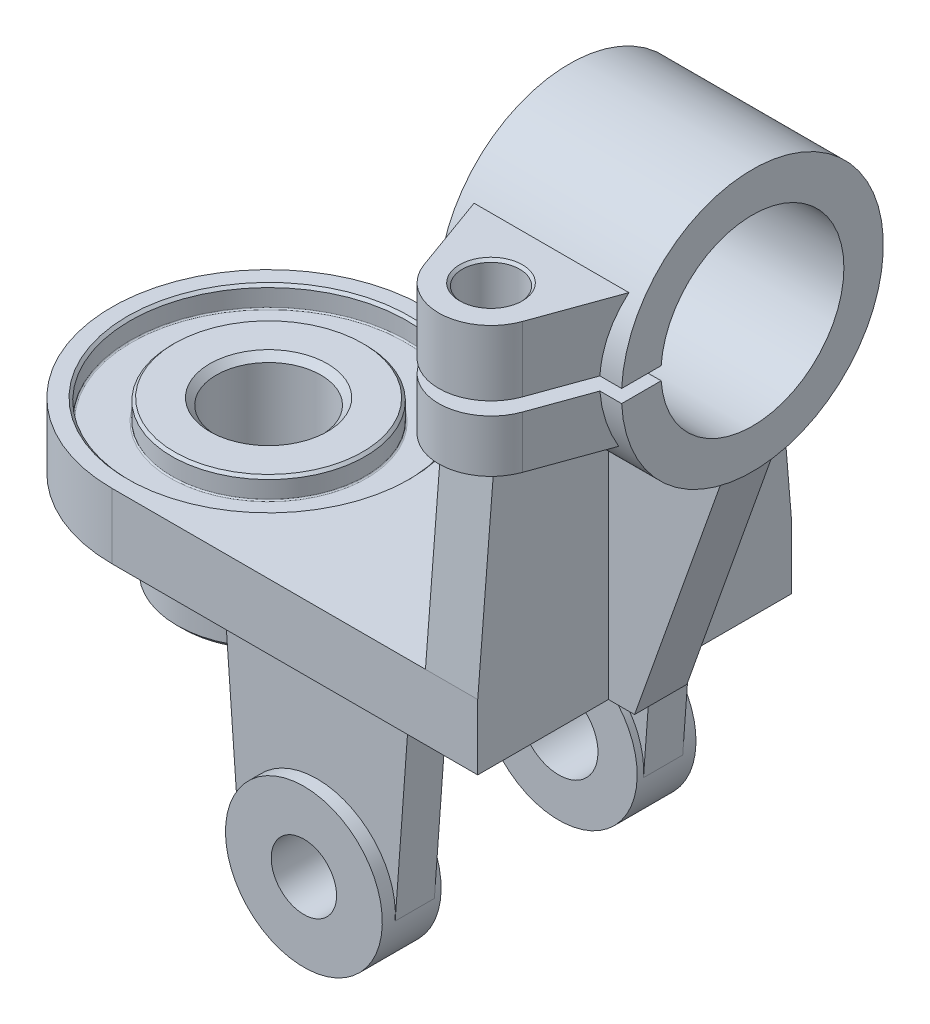
from build123d import *
from build123d.topology import SkipClean

# Parameters (mm, degrees)
CHAMFER_1_SIZE        = 2
CHAMFER_2_SIZE        = 2.5
CHAMFER_3_SIZE        = 1
FILLET_1_R            = 0.5
EXTRUDE_START         = -25
EXTRUDE_2_DEPTH       = 25
SKETCH_6_W            = 20
SKETCH_6_H            = 120
EXTRUDE_3_DEPTH       = 118
CUT_EXTRUDE_1_DEPTH   = 118
EXTRUDE_5_DEPTH       = 5
EXTRUDE_5_DEPTH_BACK  = 65
SKETCH_9_R            = 50.086542483
CUT_EXTRUDE_4_DEPTH   = 94
EXTRUDE_6_DEPTH       = 70
EXTRUDE_6_2_DEPTH     = 70
SKETCH_12_OUTSIDE_W   = 319.952
SKETCH_12_OUTSIDE_H   = 219.865
CUT_EXTRUDE_5_DEPTH   = 70
SKETCH_13_R           = 11
CUT_EXTRUDE_6_DEPTH   = 25
SKETCH_14_R           = 10
CUT_EXTRUDE_7_DEPTH   = 20
CHAMFER_4_SIZE        = 1
SKETCH_15_W           = 22.5
SKETCH_15_H           = 30
SKETCH_16_W           = 101.527747387
SKETCH_16_H           = 88.176453892
EXTRUDE_7_DEPTH       = 20
SKETCH_16_3_W         = 101.527747387
SKETCH_16_3_H         = 88.176453892
CUT_EXTRUDE_8_DEPTH   = 5
SKETCH_17_OUTSIDE_W   = 328.284
SKETCH_17_OUTSIDE_H   = 373.371
CUT_EXTRUDE_9_DEPTH   = 31
SKETCH_18_R           = 12.5
CUT_EXTRUDE_10_DEPTH  = 31
SKETCH_19_R           = 15
CUT_EXTRUDE_11_DEPTH  = 31
EXTRUDE_10_DEPTH      = 10
EXTRUDE_10_DEPTH_BACK = 10


with BuildPart() as part:
    # Эскиз1 → Повернуть1 (revolve)
    with BuildSketch(Plane.XY):
        Polygon((-20, 0), (-37, 0), (-37, -8), (-53, -8), (-53, 0), (-60, 0), (-60, -25), (-35, -25), (-35, -60), (-20, -60), align=None)
    revolve(axis=Axis((0, 0, 0), (0, -1, 0)))

    # Фаска1
    chamfer_1_edges = [part.edges().sort_by_distance(p)[0] for p in [
        (35, -60, 0),
    ]]
    chamfer(chamfer_1_edges, length=CHAMFER_1_SIZE)

    # Фаска2
    chamfer_2_edges = [part.edges().sort_by_distance(p)[0] for p in [
        (20, 0, 0),
    ]]
    chamfer(chamfer_2_edges, length=CHAMFER_2_SIZE)

    # Фаска3
    chamfer_3_edges = [part.edges().sort_by_distance(p)[0] for p in [
        (37, 0, 0),
        (53, 0, 0),
    ]]
    chamfer(chamfer_3_edges, length=CHAMFER_3_SIZE)

    # Скругление1
    fillet_1_edges = [part.edges().sort_by_distance(p)[0] for p in [
        (37, -8, 0),
        (53, -8, 0),
    ]]
    fillet(fillet_1_edges, radius=FILLET_1_R)

    # Эскиз5 → Бобышка-Вытянуть2 (add)
    with BuildSketch(Plane(origin=(0, 0, 0), x_dir=(1, 0, 0), z_dir=(0, 1, 0)).offset(EXTRUDE_START)):
        with BuildLine():
            Line((0, 60), (140, 60))
            Line((140, 60), (140, -60))
            Line((140, -60), (0, -60))
            ThreePointArc((0, -60), (60, 0), (0, 60))
        make_face()
    extrude(amount=EXTRUDE_2_DEPTH)

    # Эскиз6 → Бобышка-Вытянуть3 (add)
    with BuildSketch(Plane(origin=(0, 0, 0), x_dir=(1, 0, 0), z_dir=(0, 1, 0))):
        with Locations((130, 0)):
            Rectangle(SKETCH_6_W, SKETCH_6_H)
    extrude(amount=EXTRUDE_3_DEPTH)

    # Эскиз7 → Вырез-Вытянуть1 (cut)
    with BuildSketch(Plane.ZY.offset(-120)):
        with BuildLine():
            Line((-60, 0), (-49.827512135, 122.149582442))
            ThreePointArc((-49.827512135, 122.149582442), (0, 68), (49.827512135, 122.149582442))
            Line((49.827512135, 122.149582442), (60, 0))
            Line((60, 0), (78.244370195, 0))
            Line((78.244370195, 0), (78.244370195, 203.028010563))
            Line((78.244370195, 203.028010563), (-76.097195673, 203.028010563))
            Line((-76.097195673, 203.028010563), (-76.097195673, 0))
            Line((-76.097195673, 0), (-60, 0))
        make_face()
    extrude(amount=-CUT_EXTRUDE_1_DEPTH, mode=Mode.SUBTRACT)

    # Эскиз9 → Бобышка-Вытянуть5 (add, two sides: drawn at the far end of the back side and taken through both)
    with BuildSketch(Plane.ZY.offset(-120).offset(-EXTRUDE_5_DEPTH_BACK)):
        with Locations((-0.086542483, 118)):
            Circle(SKETCH_9_R)
    extrude(amount=EXTRUDE_5_DEPTH + EXTRUDE_5_DEPTH_BACK)

    # Эскиз10 → Вырез-Вытянуть4 (cut)
    with BuildSketch(Plane.ZY.offset(-115)):
        with BuildLine():
            Line((34.824057626, 120.5), (59.913457517, 120.5))
            Line((59.913457517, 120.5), (59.913457517, 115.5))
            Line((59.913457517, 115.5), (34.824057626, 115.5))
            ThreePointArc((34.824057626, 115.5), (-35.086542483, 118), (34.824057626, 120.5))
        make_face()
    extrude(amount=-CUT_EXTRUDE_4_DEPTH, mode=Mode.SUBTRACT)


with BuildPart() as body_2:
    # Эскиз11 → Бобышка-Вытянуть6 (new body)
    with BuildSketch(Plane.ZY.offset(-115)):
        with BuildLine():
            Line((34.824057626, 120.5), (84.913457517, 120.5))
            Line((84.913457517, 120.5), (84.913457517, 145.5))
            Line((84.913457517, 145.5), (21.564092612, 145.5))
            ThreePointArc((21.564092612, 145.5), (30.833407904, 134.399898416), (34.824057626, 120.5))
        make_face()
    extrude(amount=-EXTRUDE_6_DEPTH)


with BuildPart() as body_3:
    # Эскиз11 → Extrude 6 2 (new body)
    with BuildSketch(Plane.ZY.offset(-115)):
        with BuildLine():
            Line((34.824057626, 115.5), (84.913457517, 115.5))
            Line((84.913457517, 115.5), (84.913457517, 95.5))
            Line((84.913457517, 95.5), (26.722970754, 95.5))
            ThreePointArc((26.722970754, 95.5), (32.353295646, 104.860102659), (34.824057626, 115.5))
        make_face()
    extrude(amount=-EXTRUDE_6_2_DEPTH)


with BuildPart() as cut_extrude_5_tool:
    # Эскиз12 outside → Вырез-Вытянуть5 (new body)
    with BuildSketch(Plane(origin=(0, 145.5, 0), x_dir=(1, 0, 0), z_dir=(0, 1, 0))):
        with Locations((62.5, -12.4565)):
            Rectangle(SKETCH_12_OUTSIDE_W, SKETCH_12_OUTSIDE_H)
        with BuildLine():
            Line((115, -26.888413915), (131.18954801, -71.708080091))
            ThreePointArc((131.18954801, -71.708080091), (150, -84.913457517), (168.81045199, -71.708080091))
            Line((168.81045199, -71.708080091), (185, -26.888413915))
            Line((185, -26.888413915), (185, -21.564092612))
            Line((185, -21.564092612), (115, -21.564092612))
            Line((115, -21.564092612), (115, -26.888413915))
        make_face(mode=Mode.SUBTRACT)
    extrude(amount=-CUT_EXTRUDE_5_DEPTH)


with BuildPart() as body_3_1:
    add(body_3.part)

    # Вырез-Вытянуть5: cut by cut_extrude_5_tool
    add(cut_extrude_5_tool.part, mode=Mode.SUBTRACT)

    # Эскиз14 → Вырез-Вытянуть7 (cut)
    with BuildSketch(Plane.XZ.offset(-95.5)):
        with Locations(Location((150, 64.913457517, 0), (0, 0, 270))):
            Circle(SKETCH_14_R)
    extrude(amount=-CUT_EXTRUDE_7_DEPTH, mode=Mode.SUBTRACT)


with BuildPart() as body_2_1:
    add(body_2.part)

    # Вырез-Вытянуть5: cut by cut_extrude_5_tool
    add(cut_extrude_5_tool.part, mode=Mode.SUBTRACT)

    # Эскиз13 → Вырез-Вытянуть6 (cut)
    with BuildSketch(Plane(origin=(0, 145.5, 0), x_dir=(1, 0, 0), z_dir=(0, 1, 0))):
        with Locations(Location((150, -64.913457517, 0), (0, 0, 270))):
            Circle(SKETCH_13_R)
    extrude(amount=-CUT_EXTRUDE_6_DEPTH, mode=Mode.SUBTRACT)

    # Фаска4
    chamfer_4_edges = [body_2_1.edges().sort_by_distance(p)[0] for p in [
        (150, 145.5, 53.913457517),
    ]]
    chamfer(chamfer_4_edges, length=CHAMFER_4_SIZE)

    # Combine 2: union body 3, part
    add(body_3_1.part)
    add(part.part)


with BuildPart() as body_2_2:
    # Эскиз15 → Повернуть2 (revolve)
    with BuildSketch(Plane(origin=(73.5, 0, 0), x_dir=(0, 0, -1), z_dir=(1, 0, 0)), mode=Mode.PRIVATE) as revolve_2_sk:
        with Locations((48.75, -107)):
            Rectangle(SKETCH_15_W, SKETCH_15_H)
        with Locations((-48.75, -107)):
            Rectangle(SKETCH_15_W, SKETCH_15_H)
    revolve(revolve_2_sk.sketch.rotate(Axis((73.5, -92, -50.70001179), (0, 0, 1)), 180), axis=Axis((73.5, -92, -50.70001179), (0, 0, 1)))


with BuildPart() as body_3_2:
    # Эскиз16 → Бобышка-Вытянуть7 (new body)
    with BuildSketch(Plane.XY.offset(60)):
        with Locations((81.050138359, -69.088226946)):
            Rectangle(SKETCH_16_W, SKETCH_16_H)
    extrude(amount=-EXTRUDE_7_DEPTH)

    # Эскиз16<3> → Вырез-Вытянуть8 (cut)
    with BuildSketch(Plane.XY.offset(60)):
        with Locations((81.050138359, -69.088226946)):
            Rectangle(SKETCH_16_3_W, SKETCH_16_3_H)
    extrude(amount=-CUT_EXTRUDE_8_DEPTH, mode=Mode.SUBTRACT)

    # Эскиз17 outside → Вырез-Вытянуть9 (cut)
    with BuildSketch(Plane.XY.offset(55)):
        with Locations((62.5, 23.0435)):
            Rectangle(SKETCH_17_OUTSIDE_W, SKETCH_17_OUTSIDE_H)
        with BuildLine():
            Line((38.5, -25), (43.580535523, -94.196735174))
            ThreePointArc((43.580535523, -94.196735174), (73.5, -62), (103.419464477, -94.196735174))
            Line((103.419464477, -94.196735174), (108.5, -25))
            Line((108.5, -25), (38.5, -25))
        make_face(mode=Mode.SUBTRACT)
    extrude(amount=-CUT_EXTRUDE_9_DEPTH, mode=Mode.SUBTRACT)


with BuildPart() as body_4:
    # Зеркальное отражение1: mirrored copy
    add(body_3_2.part.mirror(Plane.XY))


with BuildPart() as body_2_3:
    add(body_2_1.part)

    # Combine 3: union body 3 2, body 2 2, body 4
    add(body_3_2.part)
    add(body_2_2.part)
    add(body_4.part)

    # Эскиз18 → Вырез-Вытянуть10 (cut)
    with BuildSketch(Plane.XY.offset(60)):
        with Locations((73.5, -92)):
            Circle(SKETCH_18_R)
    extrude(amount=-CUT_EXTRUDE_10_DEPTH, mode=Mode.SUBTRACT)

    # Эскиз19 → Вырез-Вытянуть11 (cut)
    with BuildSketch(Plane(origin=(0, 0, -60), x_dir=(-1, 0, 0), z_dir=(0, 0, -1))):
        with Locations(Location((-73.5, -92, 0), (0, 0, 90))):
            Circle(SKETCH_19_R)
    extrude(amount=-CUT_EXTRUDE_11_DEPTH, mode=Mode.SUBTRACT)


with BuildPart() as body_2_3_1:
    # Эскиз20 → Бобышка-Вытянуть10 (new, two sides: drawn at the far end of the back side and taken through both)
    with BuildSketch(Plane.XY.offset(-EXTRUDE_10_DEPTH_BACK)):
        Polygon((140, 67.913457517), (140, -25), (150, -25), (183, 67.913457517), (185, 73.544576154), (140, 73.464396167), align=None)
    extrude(amount=EXTRUDE_10_DEPTH + EXTRUDE_10_DEPTH_BACK)

    # Combine 4: union body 2
    add(body_2_3.part)


solid = body_2_3_1.part
